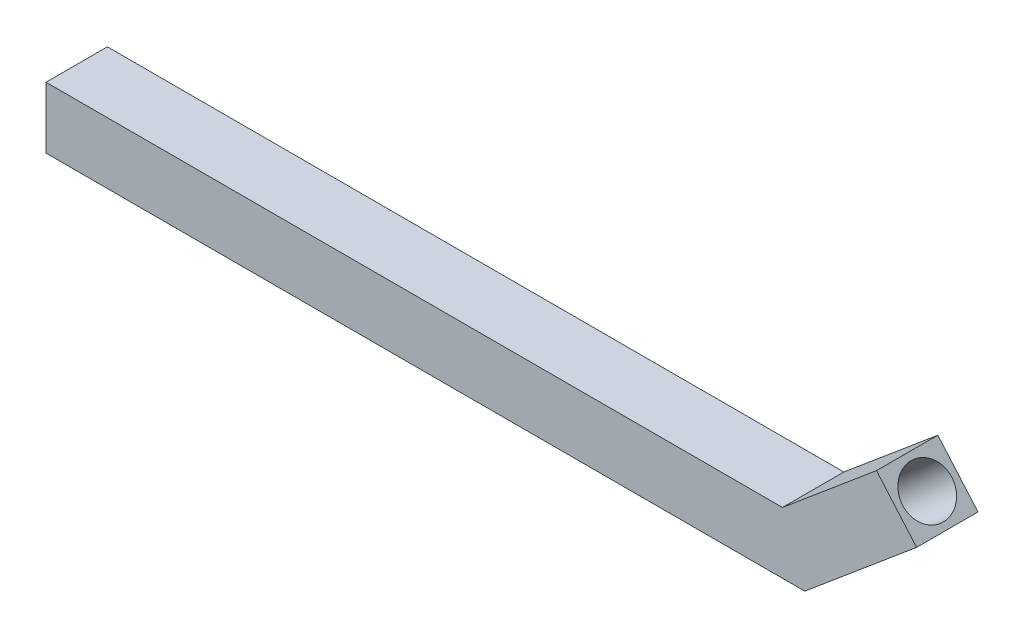
from build123d import *

# Parameters (mm, degrees)
BOSS_EXTRUDE1_DEPTH = 2.5
SKETCH2_R           = 1
CUT_EXTRUDE1_DEPTH  = 5
SKETCH3_R           = 1
CUT_EXTRUDE2_DEPTH  = 5
SKETCH5_R           = 1
BOSS_EXTRUDE2_DEPTH = 5
SKETCH6_W           = 2.5
SKETCH6_H           = 2.5
BOSS_EXTRUDE3_DEPTH = 25
SKETCH7_R           = 1
CUT_EXTRUDE3_DEPTH  = 5


with BuildPart() as part:
    # Sketch1 → Boss-Extrude1 (new body)
    with BuildSketch(Plane.XY):
        Polygon((-5, 0), (0, 0), (3.830222216, 3.213938048), (5.465982834, 1.323359513), (0.909480399, -2.5), (-5, -2.5), align=None)
    extrude(amount=BOSS_EXTRUDE1_DEPTH)

    # Sketch2 → Cut-Extrude1 (cut)
    with BuildSketch(Plane(origin=(3.780724263, 3.271146765, 0), x_dir=(0, 0, -1), z_dir=(0.7562314141303861, 0.6543042474891606, 0))):
        with Locations(Location((-1.25, -1.325649749, 0), (0, 0, 90))):
            Circle(SKETCH2_R)
    extrude(amount=-CUT_EXTRUDE1_DEPTH, mode=Mode.SUBTRACT)

    # Sketch3 → Cut-Extrude2 (cut)
    with BuildSketch(Plane.ZY.offset(5)):
        with Locations((1.25, -1.25)):
            Circle(SKETCH3_R)
    extrude(amount=-CUT_EXTRUDE2_DEPTH, mode=Mode.SUBTRACT)

    # Sketch5 → Boss-Extrude2 (add)
    with BuildSketch(Plane.ZY.offset(5)):
        with Locations((1.25, -1.25)):
            Circle(SKETCH5_R)
    extrude(amount=-BOSS_EXTRUDE2_DEPTH)

    # Sketch6 → Boss-Extrude3 (add)
    with BuildSketch(Plane.ZY.offset(5)):
        with Locations((1.25, -1.25)):
            Rectangle(SKETCH6_W, SKETCH6_H)
    extrude(amount=BOSS_EXTRUDE3_DEPTH)

    # Sketch7 → Cut-Extrude3 (cut)
    with BuildSketch(Plane.ZY.offset(30)):
        with Locations((1.25, -1.25)):
            Circle(SKETCH7_R)
    extrude(amount=-CUT_EXTRUDE3_DEPTH, mode=Mode.SUBTRACT)


solid = part.part
